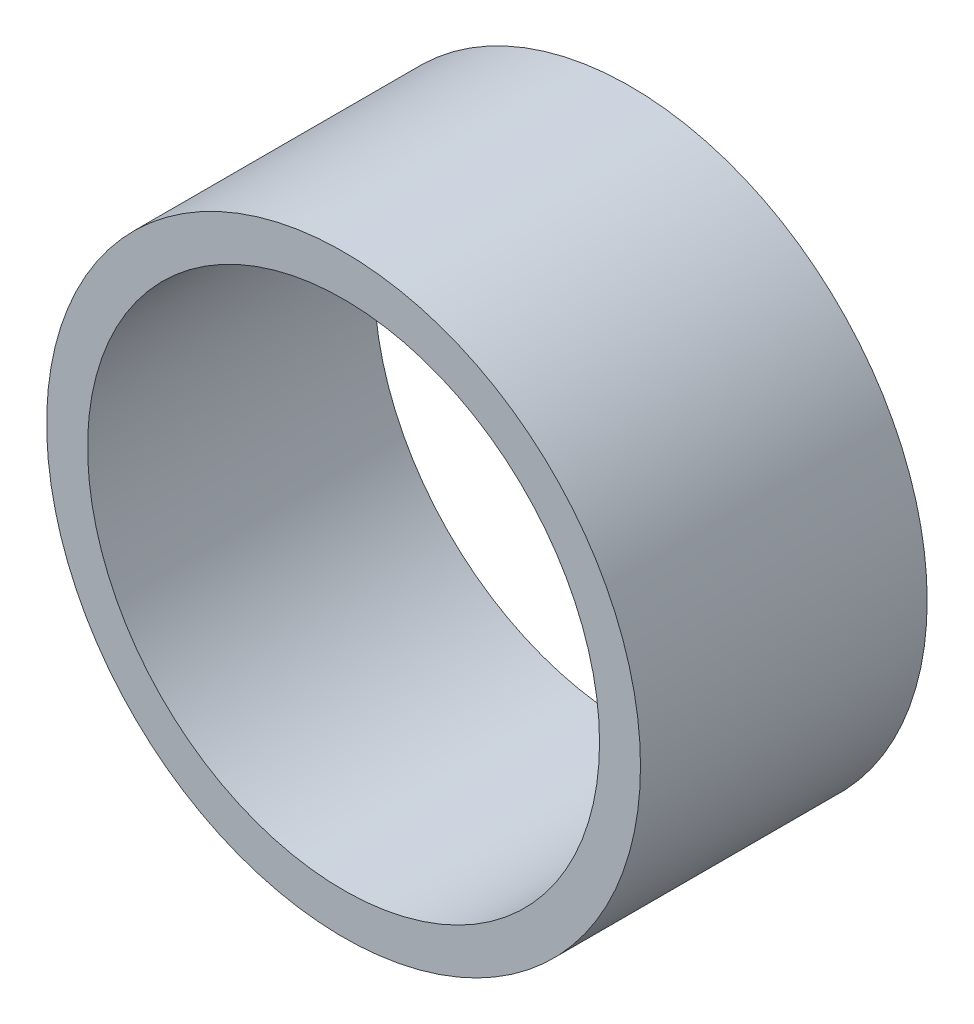
from build123d import *

# Parameters (mm, degrees)
SKETCH_1_R      = 3.625
SKETCH_1_R_2    = 3.125
EXTRUDE_1_DEPTH = 3.5


with BuildPart() as part:
    # ｽｹｯﾁ1 → ﾎﾞｽ - 押し出し1 (new body)
    with BuildSketch(Plane.XY):
        Circle(SKETCH_1_R)
        Circle(SKETCH_1_R_2, mode=Mode.SUBTRACT)
    extrude(amount=EXTRUDE_1_DEPTH)


solid = part.part
